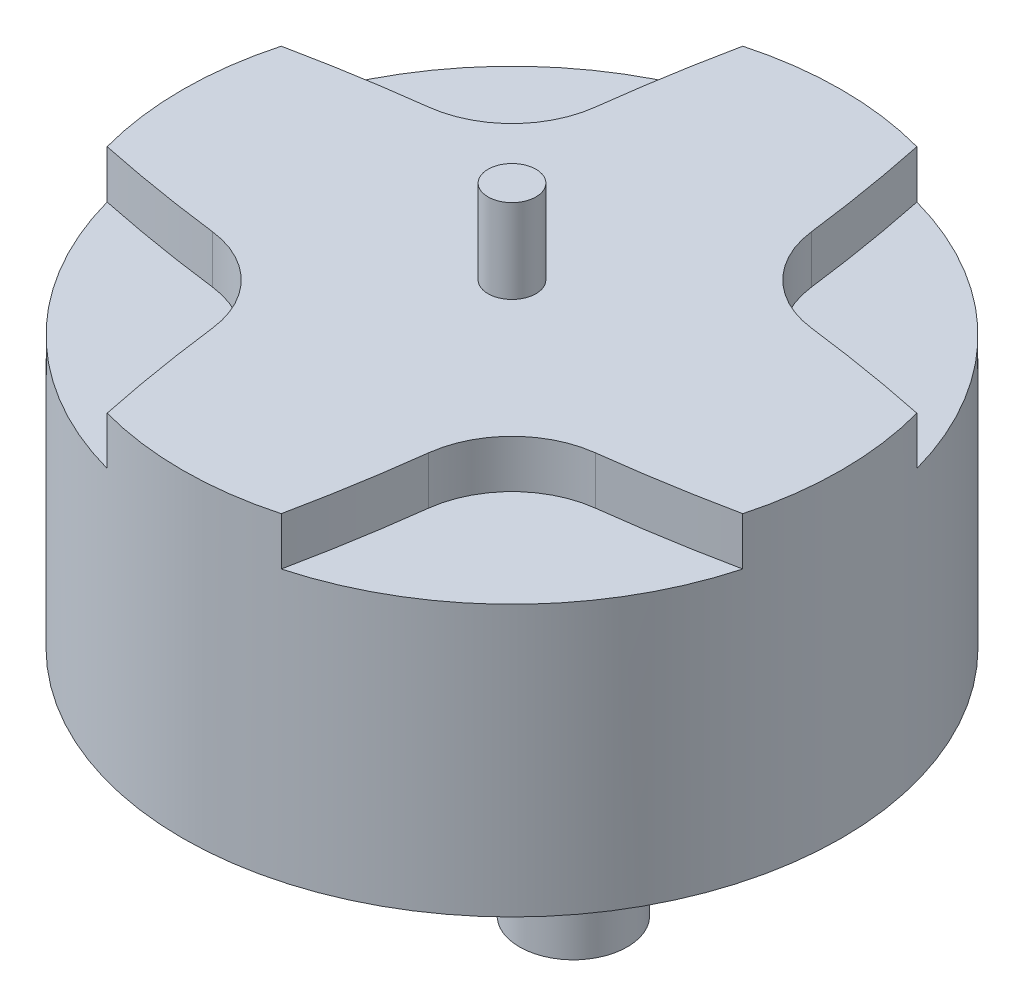
from build123d import *
from build123d.topology import SkipClean

# Parameters (mm, degrees)
SKETCH_1_R      = 1.25
EXTRUDE_1_DEPTH = 2.5
FILLET_1_R      = 2
SKETCH_2_R      = 4.625
EXTRUDE_2_DEPTH = 13.7
SKETCH_3_R      = 1
EXTRUDE_3_DEPTH = 5.5
EXTRUDE_4_DEPTH = 2
EXTRUDE_START   = 11.3
SKETCH_5_R      = 13.75
EXTRUDE_5_DEPTH = 11.3
FILLET_2_R      = 4


with BuildPart() as part:
    # 草图1 → 凸台-拉伸1 (new body)
    with BuildSketch(Plane(origin=(0, 0, 0), x_dir=(1, 0, 0), z_dir=(0, 1, 0))):
        with BuildLine():
            Line((-1.948557159, 5.875), (-6.062177826, -1.25))
            ThreePointArc((-6.062177826, -1.25), (-8.010734985, -4.625), (-4.113620668, -4.625))
            Line((-4.113620668, -4.625), (4.113620668, -4.625))
            ThreePointArc((4.113620668, -4.625), (8.010734985, -4.625), (6.062177826, -1.25))
            Line((6.062177826, -1.25), (1.948557159, 5.875))
            ThreePointArc((1.948557159, 5.875), (0, 9.25), (-1.948557159, 5.875))
        make_face()
        with Locations(Location((0, 7, 0), (0, 0, 270))):
            Circle(SKETCH_1_R, mode=Mode.SUBTRACT)
        with Locations(Location((-6.062177826, -3.5, 0), (0, 0, 270))):
            Circle(SKETCH_1_R, mode=Mode.SUBTRACT)
        with Locations(Location((6.062177826, -3.5, 0), (0, 0, 270))):
            Circle(SKETCH_1_R, mode=Mode.SUBTRACT)
    extrude(amount=EXTRUDE_1_DEPTH)

    # 圆角1
    fillet_1_edges = [part.edges().sort_by_distance(p)[0] for p in [
        (-6.062177826, 1.25, 1.25),
        (-1.948557159, 1.25, -5.875),
        (1.948557159, 1.25, -5.875),
        (6.062177826, 1.25, 1.25),
        (4.113620668, 1.25, 4.625),
        (-4.113620668, 1.25, 4.625),
    ]]
    fillet(fillet_1_edges, radius=FILLET_1_R)

    # 草图2 → 凸台-拉伸2 (add)
    with BuildSketch(Plane(origin=(0, 2.5, 0), x_dir=(1, 0, 0), z_dir=(0, 1, 0))):
        with Locations(Location((0, 0, 0), (0, 0, 270))):
            Circle(SKETCH_2_R)
    extrude(amount=EXTRUDE_2_DEPTH)

    # 草图3 → 凸台-拉伸3 (add)
    with BuildSketch(Plane(origin=(0, 16.2, 0), x_dir=(1, 0, 0), z_dir=(0, 1, 0))):
        with Locations(Location((0, 0, 0), (0, 0, 270))):
            Circle(SKETCH_3_R)
    extrude(amount=EXTRUDE_3_DEPTH)

    # 草图4 → 凸台-拉伸4 (add)
    with BuildSketch(Plane(origin=(0, 16.2, 0), x_dir=(1, 0, 0), z_dir=(0, 1, 0))):
        with BuildLine():
            ThreePointArc((-3.6328125, -13.261416717), (0, -13.75), (3.6328125, -13.261416717))
            ThreePointArc((3.6328125, -13.261416717), (4.365393547, -9.060690569), (4.820970693, -4.820970693))
            ThreePointArc((4.820970693, -4.820970693), (9.060690569, -4.365393547), (13.261416717, -3.6328125))
            ThreePointArc((13.261416717, -3.6328125), (13.75, 0), (13.261416717, 3.6328125))
            ThreePointArc((13.261416717, 3.6328125), (9.060690569, 4.365393547), (4.820970693, 4.820970693))
            ThreePointArc((4.820970693, 4.820970693), (4.365393547, 9.060690569), (3.6328125, 13.261416717))
            ThreePointArc((3.6328125, 13.261416717), (0, 13.75), (-3.6328125, 13.261416717))
            ThreePointArc((-3.6328125, 13.261416717), (-4.365393547, 9.060690569), (-4.820970693, 4.820970693))
            ThreePointArc((-4.820970693, 4.820970693), (-9.060690569, 4.365393547), (-13.261416717, 3.6328125))
            ThreePointArc((-13.261416717, 3.6328125), (-13.75, 0), (-13.261416717, -3.6328125))
            ThreePointArc((-13.261416717, -3.6328125), (-9.060690569, -4.365393547), (-4.820970693, -4.820970693))
            ThreePointArc((-4.820970693, -4.820970693), (-4.365393547, -9.060690569), (-3.6328125, -13.261416717))
        make_face()
    extrude(amount=EXTRUDE_4_DEPTH)

    # 草图5 → 凸台-拉伸5 (add)
    with SkipClean():  # the faces are left unmerged after this step: merging them gives an invalid solid
        with BuildSketch(Plane.XZ.offset(-16.2).offset(EXTRUDE_START)):
            with Locations(Location((0, 0, 0), (0, 0, 270))):
                Circle(SKETCH_5_R)
        extrude(amount=-EXTRUDE_5_DEPTH)

    # 圆角2
    fillet_2_edges = [part.edges().sort_by_distance(p)[0] for p in [
        (-4.820970693, 17.2, 4.820970693),
        (4.820970693, 17.2, 4.820970693),
        (4.820970693, 17.2, -4.820970693),
        (-4.820970693, 17.2, -4.820970693),
    ]]
    fillet(fillet_2_edges, radius=FILLET_2_R)


solid = part.part
